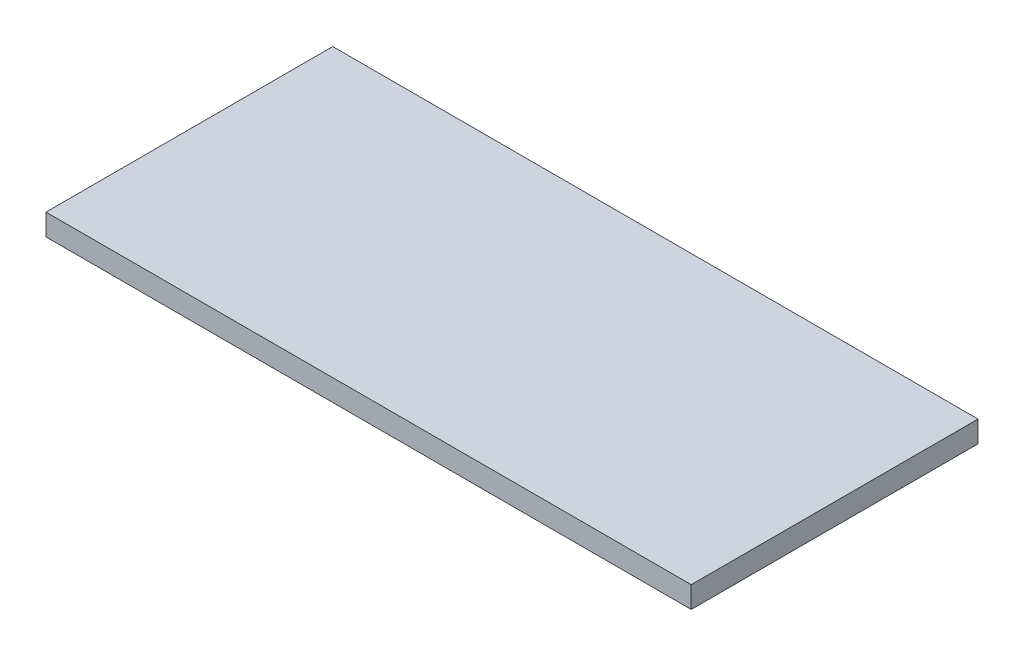
from build123d import *

# Parameters (mm, degrees)
SKETCH1_W           = 90
SKETCH1_H           = 40
BOSS_EXTRUDE1_DEPTH = 3


with BuildPart() as part:
    # Sketch1 → Boss-Extrude1 (new body)
    with BuildSketch(Plane(origin=(0, 0, 0), x_dir=(1, 0, 0), z_dir=(0, 1, 0))):
        with Locations((-4.090909091, 2.98553719)):
            Rectangle(SKETCH1_W, SKETCH1_H)
    extrude(amount=BOSS_EXTRUDE1_DEPTH)


solid = part.part
